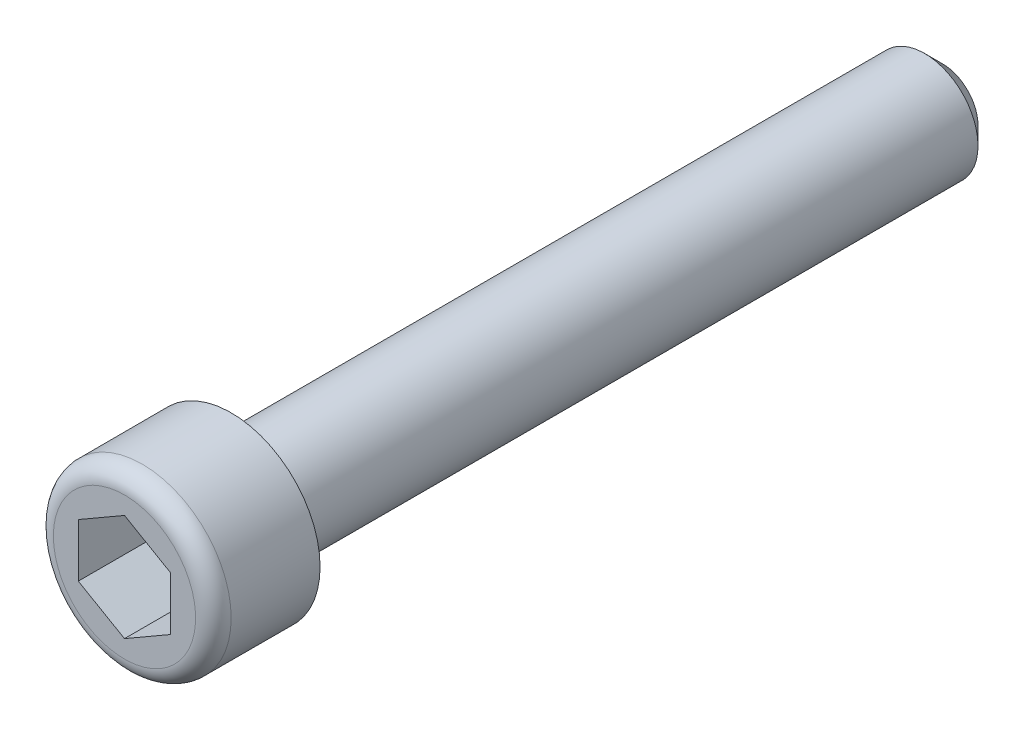
from build123d import *

# Parameters (mm, degrees)
FOOTPRINT_DEPTH = 4.5
CHAMFER1_SIZE   = 1
FILLET1_R       = 1


with BuildPart() as part:
    # Sketch1 → Body (revolve)
    with BuildSketch(Plane(origin=(0, 0, 0), x_dir=(0, 0, -1), z_dir=(1, 0, 0)), mode=Mode.PRIVATE) as body_sk:
        Polygon((0, 0), (0, 5), (6, 5), (6, 3), (46, 3), (46, 0), align=None)
    revolve(body_sk.sketch.rotate(Axis((0, 0, 156.291575099), (0, 0, -1)), 90), axis=Axis((0, 0, 156.291575099), (0, 0, -1)))

    # Sketch2 → Footprint (cut)
    with BuildSketch(Plane.XY):
        Polygon((0, 3), (-2.598076211, 1.5), (-2.598076211, -1.5), (0, -3), (2.598076211, -1.5), (2.598076211, 1.5), align=None)
    extrude(amount=-FOOTPRINT_DEPTH, mode=Mode.SUBTRACT)

    # Chamfer1
    chamfer1_edges = [part.edges().sort_by_distance(p)[0] for p in [
        (-3, 0, -46),
    ]]
    chamfer(chamfer1_edges, length=CHAMFER1_SIZE)

    # Fillet1
    fillet1_edges = [part.edges().sort_by_distance(p)[0] for p in [
        (-5, 0, 0),
    ]]
    fillet(fillet1_edges, radius=FILLET1_R)


solid = part.part
